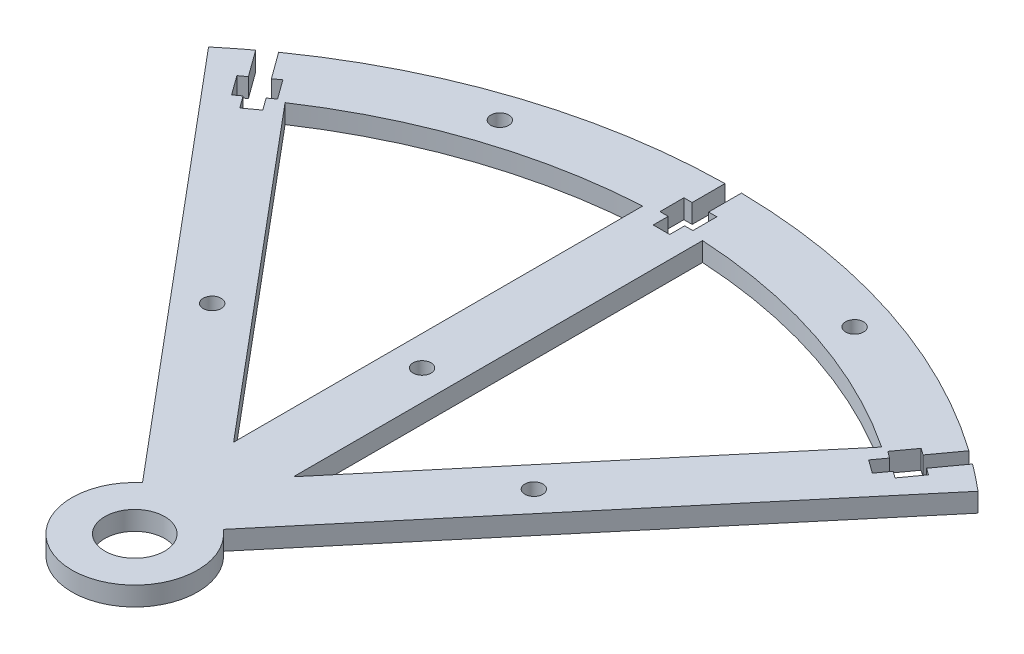
from build123d import *

# Parameters (mm, degrees)
SKETCH1_R                       = 5
BOSS_EXTRUDE1_DEPTH             = 3.175
SKETCH6_W                       = 2.75
SKETCH6_H                       = 2.5
SKETCH6_H_2                     = 4
SKETCH6_W_2                     = 1.375
CUT_EXTRUDE4_DEPTH              = 109.300618445
CIRPATTERN1_COUNT               = 2
CIRPATTERN1_ANGLE               = 36
CIRPATTERN1_THE_OTHER_WAY_COUNT = 2
CIRPATTERN1_THE_OTHER_WAY_ANGLE = 36
F_3_0_3_DIAMETER_HOLE1_D        = 3


with BuildPart() as part:
    # Sketch1 → Boss-Extrude1 (new body)
    with BuildSketch(Plane(origin=(0, 0, 0), x_dir=(1, 0, 0), z_dir=(0, 1, 0))):
        with BuildLine():
            Line((-64.278760969, 0), (-6.749269902, -68.560977659))
            ThreePointArc((-6.749269902, -68.560977659), (0, -87.104444312), (6.749269902, -68.560977659))
            Line((6.749269902, -68.560977659), (64.278760969, 0))
            ThreePointArc((64.278760969, 0), (0, 23.395555688), (-64.278760969, 0))
        make_face()
        with Locations(Location((0, -76.604444312, 0), (0, 0, 270))):
            Circle(SKETCH1_R, mode=Mode.SUBTRACT)
        with BuildLine():
            Line((-49.832227183, -1.659470271), (-5, -55.08843808))
            Line((-5, -55.08843808), (-5, 13.256559466))
            ThreePointArc((-5, 13.256559466), (-28.412414016, 8.793065779), (-49.832227183, -1.659470271))
        make_face(mode=Mode.SUBTRACT)
        with BuildLine():
            Line((5, -55.08843808), (49.832227183, -1.659470271))
            ThreePointArc((49.832227183, -1.659470271), (28.412414016, 8.793065779), (5, 13.256559466))
            Line((5, 13.256559466), (5, -55.08843808))
        make_face(mode=Mode.SUBTRACT)
    extrude(amount=BOSS_EXTRUDE1_DEPTH)

    # Sketch6 → Cut-Extrude4 (cut, through all)
    with BuildSketch(Plane(origin=(0, 3.175, 0), x_dir=(1, 0, 0), z_dir=(0, 1, 0))):
        with Locations((0, 12.645555688)):
            Rectangle(SKETCH6_W, SKETCH6_H)
        with Locations((0, 15.895555688)):
            Rectangle(SKETCH6_W, SKETCH6_H_2)
        with Locations((-2.0625, 15.895555688)):
            Rectangle(SKETCH6_W_2, SKETCH6_H_2)
        with BuildLine():
            Line((-1.375, 23.386102116), (-1.375, 17.895555688))
            Line((-1.375, 17.895555688), (1.375, 17.895555688))
            Line((1.375, 17.895555688), (1.375, 23.386102116))
            ThreePointArc((1.375, 23.386102116), (0.687516249, 23.393192267), (0, 23.395555688))
            ThreePointArc((0, 23.395555688), (-0.687516249, 23.393192267), (-1.375, 23.386102116))
        make_face()
        with Locations((2.0625, 15.895555688)):
            Rectangle(SKETCH6_W_2, SKETCH6_H_2)
    cut_extrude4 = extrude(amount=-CUT_EXTRUDE4_DEPTH, mode=Mode.SUBTRACT)

    # CirPattern1: Cut-Extrude4 ×2 about axis
    cirpattern1_axis = Axis((0, 0, 76.604444312), (0, -1, 0))
    for i in range(1, CIRPATTERN1_COUNT):
        add(cut_extrude4.rotate(cirpattern1_axis, i * CIRPATTERN1_ANGLE / (CIRPATTERN1_COUNT - 1)), mode=Mode.SUBTRACT)

    # CirPattern1 the other way: Cut-Extrude4 ×2 about axis
    cirpattern1_the_other_way_axis = Axis((0, 0, 76.604444312), (0, 1, 0))
    for i in range(1, CIRPATTERN1_THE_OTHER_WAY_COUNT):
        add(cut_extrude4.rotate(cirpattern1_the_other_way_axis, i * CIRPATTERN1_THE_OTHER_WAY_ANGLE / (CIRPATTERN1_THE_OTHER_WAY_COUNT - 1)), mode=Mode.SUBTRACT)

    # Ø3.0 (3) Diameter Hole1 (through all)
    with Locations(Plane(origin=(0, 3.175, 0), x_dir=(1, 0, 0), z_dir=(0, 1, 0))):
        with Locations((0, -28.604444312), (-26.874184456, -36.798419304), (26.874184456, -36.798419304), (30.19139013, 13.470413235), (-29.356614466, 13.745924736)):
            Hole(F_3_0_3_DIAMETER_HOLE1_D / 2)


solid = part.part
